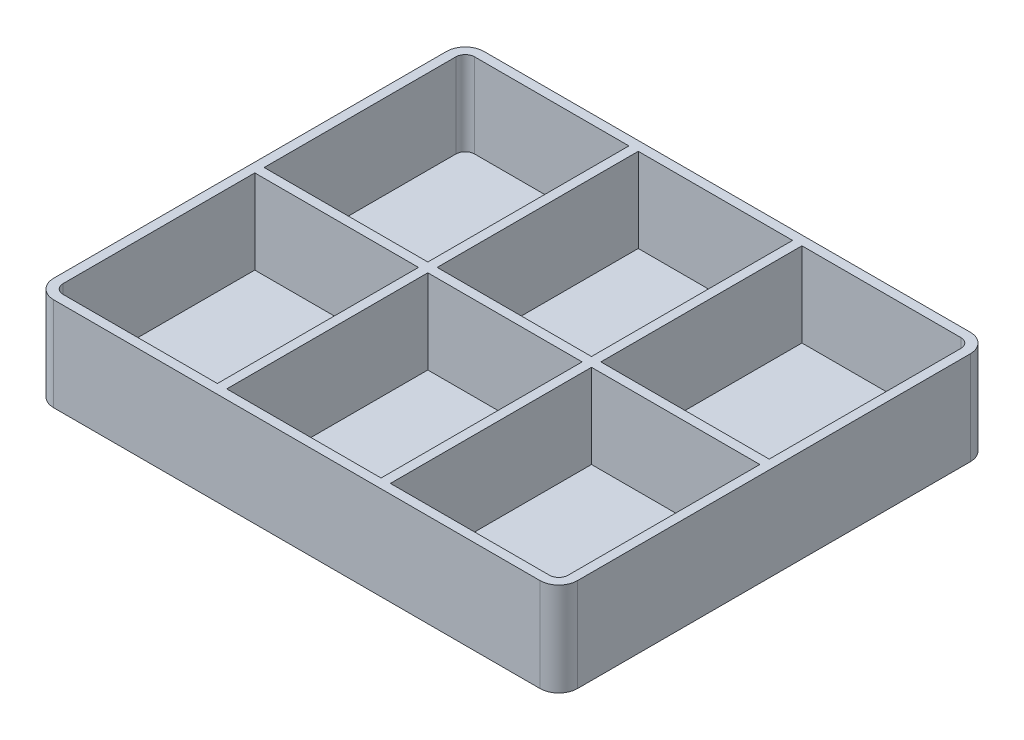
from build123d import *

# Parameters (mm, degrees)
EXTRUDE_1_DEPTH = 50
SHELL_1_T       = -5
EXTRUDE_3_DEPTH = 45


with BuildPart() as part:
    # 스케치1 → 보스-돌출1 (new body)
    with BuildSketch(Plane(origin=(0, 0, 0), x_dir=(1, 0, 0), z_dir=(0, 1, 0))):
        with BuildLine():
            Line((10, 0), (270, 0))
            ThreePointArc((270, 0), (277.071067812, 2.928932188), (280, 10))
            Line((280, 10), (280, 220))
            ThreePointArc((280, 220), (277.071067812, 227.071067812), (270, 230))
            Line((270, 230), (10, 230))
            ThreePointArc((10, 230), (2.928932188, 227.071067812), (0, 220))
            Line((0, 220), (0, 10))
            ThreePointArc((0, 10), (2.928932188, 2.928932188), (10, 0))
        make_face()
    extrude(amount=EXTRUDE_1_DEPTH)

    # 쉘1
    shell_1_openings = [part.faces().sort_by_distance(p)[0] for p in [
        (140, 50, -115),
    ]]
    offset(amount=SHELL_1_T, openings=shell_1_openings, kind=Kind.INTERSECTION)

    # 스케치4 → 보스-돌출3 (add)
    with BuildSketch(Plane(origin=(0, 5, 0), x_dir=(1, 0, 0), z_dir=(0, 1, 0))):
        Polygon((5, 117.5), (5, 112.5), (92.5, 112.5), (92.5, 5), (97.5, 5), (97.5, 112.5), (180, 112.5), (180, 5), (185, 5), (185, 112.5), (275, 112.5), (275, 117.5), (185, 117.5), (185, 225), (180, 225), (180, 117.5), (97.5, 117.5), (97.5, 225), (92.5, 225), (92.5, 117.5), align=None)
    extrude(amount=EXTRUDE_3_DEPTH)


solid = part.part
